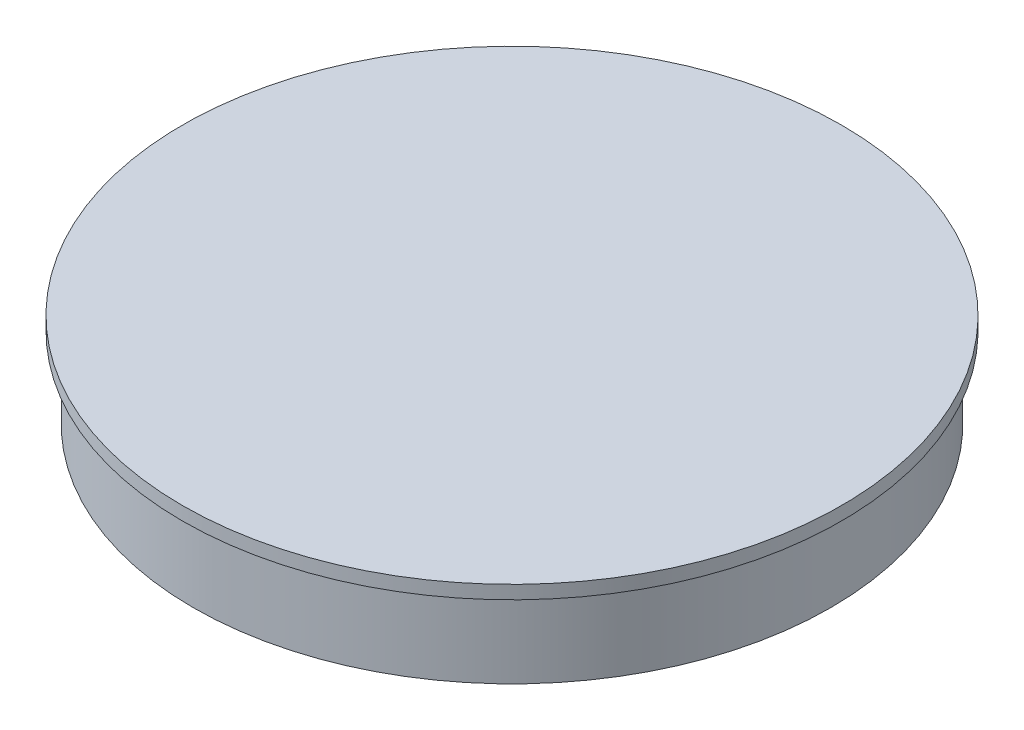
from build123d import *

# Parameters (mm, degrees)
SKETCH1_R           = 35.7
SKETCH1_R_2         = 34.7
BOSS_EXTRUDE1_DEPTH = 9
SKETCH2_R           = 36.9
BOSS_EXTRUDE2_DEPTH = 1.5


with BuildPart() as part:
    # Sketch1 → Boss-Extrude1 (new body)
    with BuildSketch(Plane(origin=(0, 0, 0), x_dir=(1, 0, 0), z_dir=(0, 1, 0))):
        with Locations(Location((0, 0, 0), (0, 0, 270))):
            Circle(SKETCH1_R)
        with Locations(Location((0, 0, 0), (0, 0, 270))):
            Circle(SKETCH1_R_2, mode=Mode.SUBTRACT)
    extrude(amount=BOSS_EXTRUDE1_DEPTH)

    # Sketch2 → Boss-Extrude2 (add)
    with BuildSketch(Plane(origin=(0, 9, 0), x_dir=(1, 0, 0), z_dir=(0, 1, 0))):
        with Locations(Location((0, 0, 0), (0, 0, 270))):
            Circle(SKETCH2_R)
    extrude(amount=BOSS_EXTRUDE2_DEPTH)


solid = part.part
